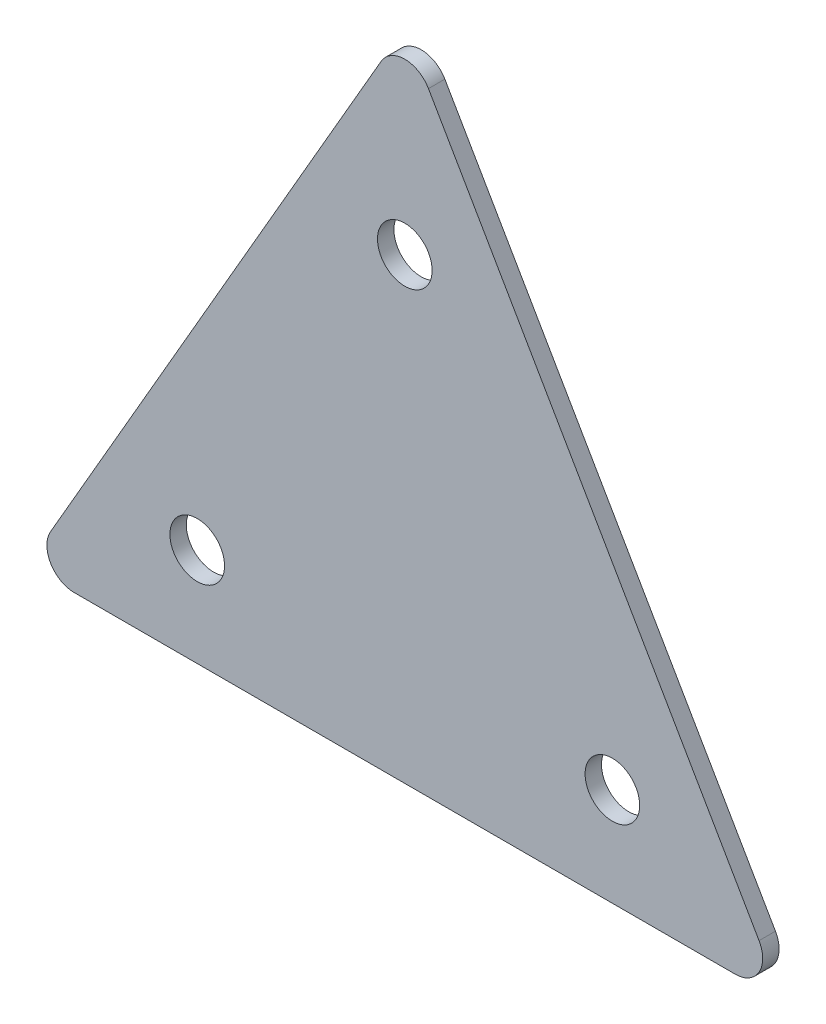
from build123d import *

# Parameters (mm, degrees)
SKETCH1_R           = 2.5
BOSS_EXTRUDE1_DEPTH = 1.5
FILLET1_R           = 2.5


with BuildPart() as part:
    # Sketch1 → Boss-Extrude1 (new body)
    with BuildSketch(Plane.XY):
        Polygon((-32.756938656, -9), (36.41997588, -9), (1.831518612, 50.908965344), align=None)
        with Locations((-17.168481388, 0)):
            Circle(SKETCH1_R, mode=Mode.SUBTRACT)
        with Locations((20.831518612, 0)):
            Circle(SKETCH1_R, mode=Mode.SUBTRACT)
        with Locations((1.831518612, 32.908965344)):
            Circle(SKETCH1_R, mode=Mode.SUBTRACT)
    extrude(amount=BOSS_EXTRUDE1_DEPTH)

    # Fillet1
    fillet1_edges = [part.edges().sort_by_distance(p)[0] for p in [
        (1.831518612, 50.908965344, 0.75),
        (36.41997588, -9, 0.75),
        (-32.756938656, -9, 0.75),
    ]]
    fillet(fillet1_edges, radius=FILLET1_R)


solid = part.part
